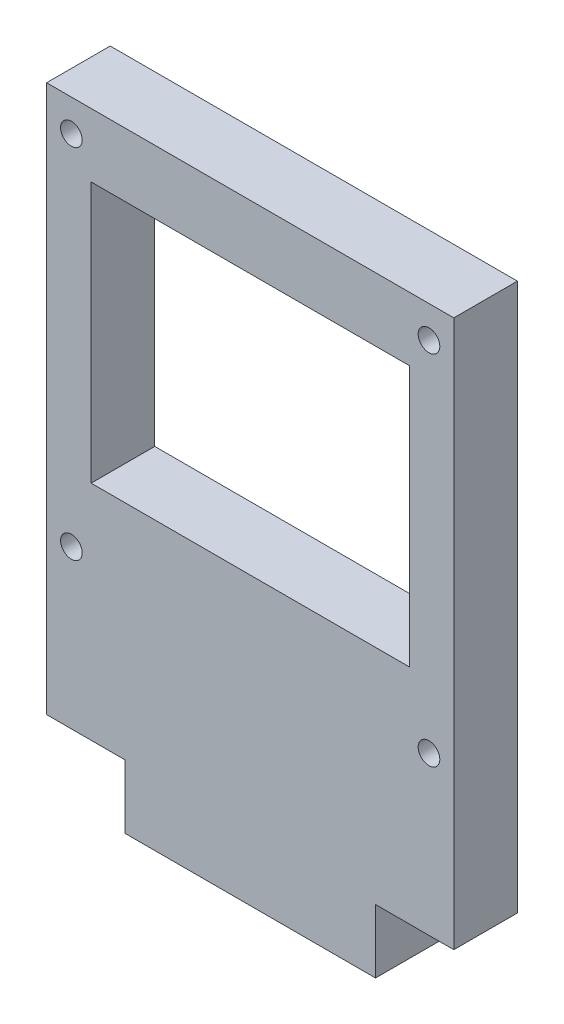
from build123d import *

# Parameters (mm, degrees)
SKETCH2_W           = 19.7
SKETCH2_H           = 5
BOSS_EXTRUDE1_DEPTH = 5
BOSS_EXTRUDE2_DEPTH = 5
SKETCH5_R           = 0.85
CUT_EXTRUDE1_DEPTH  = 5


with BuildPart() as part:
    # Sketch2 → Boss-Extrude1 (new body)
    with BuildSketch(Plane(origin=(0, 0, 0), x_dir=(1, 0, 0), z_dir=(0, 1, 0))):
        with Locations((0, 2.5)):
            Rectangle(SKETCH2_W, SKETCH2_H)
    extrude(amount=BOSS_EXTRUDE1_DEPTH)

    # Sketch4 → Boss-Extrude2 (add)
    with BuildSketch(Plane.XY):
        Polygon((-16, 5), (16, 5), (16, 48), (0, 48), (-16, 48), align=None)
        Polygon((-12.5, 22.5), (12.5, 22.5), (12.5, 43), (0, 43), (-12.5, 43), align=None, mode=Mode.SUBTRACT)
    extrude(amount=-BOSS_EXTRUDE2_DEPTH)

    # Sketch5 → Cut-Extrude1 (cut)
    with BuildSketch(Plane.XY):
        with Locations((-14.05, 45.5)):
            Circle(SKETCH5_R)
        with Locations((-14.05, 17.4)):
            Circle(SKETCH5_R)
        with Locations((14.05, 17.4)):
            Circle(SKETCH5_R)
        with Locations((14.05, 45.5)):
            Circle(SKETCH5_R)
    extrude(amount=-CUT_EXTRUDE1_DEPTH, mode=Mode.SUBTRACT)


solid = part.part
